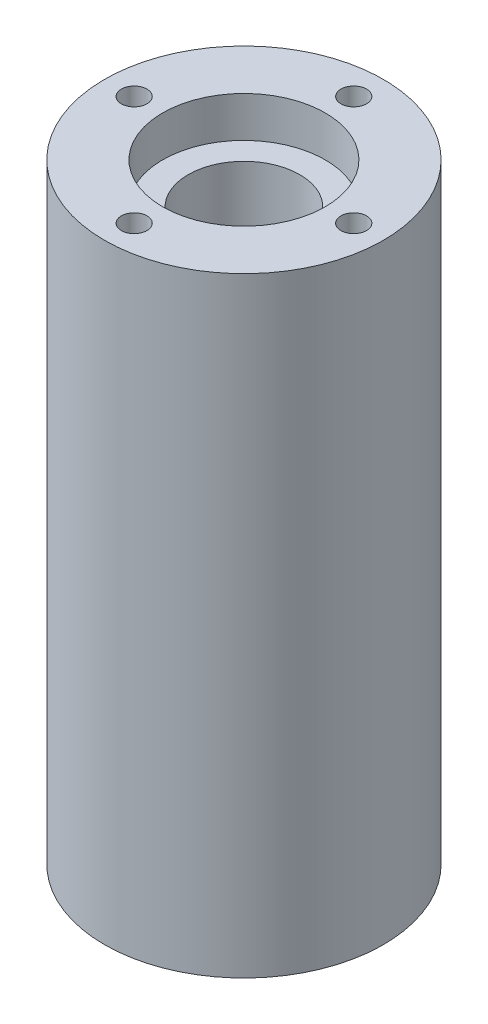
from build123d import *

# Parameters (mm, degrees)
SKETCH1_R           = 19.05
SKETCH1_R_2         = 7.62
BOSS_EXTRUDE1_DEPTH = 83.348208
SKETCH3_R           = 11.1125
CUT_EXTRUDE2_DEPTH  = 5.5562754
CUT_EXTRUDE3_START  = -5.5562754
SKETCH4_R           = 11.1125
CUT_EXTRUDE3_DEPTH  = 5.5562754
SKETCH13_R          = 1.75
CUT_EXTRUDE4_DEPTH  = 13
CIRPATTERN2_COUNT   = 4
CUT_EXTRUDE6_START  = -13
SKETCH19_R          = 1.75
CUT_EXTRUDE6_DEPTH  = 13
CIRPATTERN4_COUNT   = 4


with BuildPart() as part:
    # Sketch1 → Boss-Extrude1 (new body)
    with BuildSketch(Plane(origin=(0, 0, 0), x_dir=(1, 0, 0), z_dir=(0, 1, 0))):
        with Locations(Location((0, 0, 0), (0, 0, 270))):
            Circle(SKETCH1_R)
        with Locations(Location((0, 0, 0), (0, 0, 270))):
            Circle(SKETCH1_R_2, mode=Mode.SUBTRACT)
    extrude(amount=BOSS_EXTRUDE1_DEPTH)

    # Sketch3 → Cut-Extrude2 (cut)
    with BuildSketch(Plane(origin=(0, 83.348208, 0), x_dir=(1, 0, 0), z_dir=(0, 1, 0))):
        with Locations(Location((0, 0, 0), (0, 0, 270))):
            Circle(SKETCH3_R)
    extrude(amount=-CUT_EXTRUDE2_DEPTH, mode=Mode.SUBTRACT)

    # Sketch4 → Cut-Extrude3 (cut)
    with BuildSketch(Plane.XZ.offset(CUT_EXTRUDE3_START)):
        with Locations(Location((0, 0, 0), (0, 0, 90))):
            Circle(SKETCH4_R)
    extrude(amount=CUT_EXTRUDE3_DEPTH, mode=Mode.SUBTRACT)

    # Sketch13 → Cut-Extrude4 (cut)
    with BuildSketch(Plane(origin=(0, 83.348208, 0), x_dir=(1, 0, 0), z_dir=(0, 1, 0))):
        with Locations(Location((0, 15, 0), (0, 0, 270))):
            Circle(SKETCH13_R)
    cut_extrude4 = extrude(amount=-CUT_EXTRUDE4_DEPTH, mode=Mode.SUBTRACT)

    # CirPattern2: Cut-Extrude4 ×4 about axis
    cirpattern2_axis = Axis((0, 0, 0), (0, 1, 0))
    for i in range(1, CIRPATTERN2_COUNT):
        add(cut_extrude4.rotate(cirpattern2_axis, i * 360 / CIRPATTERN2_COUNT), mode=Mode.SUBTRACT)

    # Sketch19 → Cut-Extrude6 (cut)
    with BuildSketch(Plane.XZ.offset(CUT_EXTRUDE6_START)):
        with Locations(Location((0, 15, 0), (0, 0, 90))):
            Circle(SKETCH19_R)
    cut_extrude6 = extrude(amount=CUT_EXTRUDE6_DEPTH, mode=Mode.SUBTRACT)

    # CirPattern4: Cut-Extrude6 ×4 about axis
    cirpattern4_axis = Axis((0, 0, 0), (0, 1, 0))
    for i in range(1, CIRPATTERN4_COUNT):
        add(cut_extrude6.rotate(cirpattern4_axis, i * 360 / CIRPATTERN4_COUNT), mode=Mode.SUBTRACT)


solid = part.part
